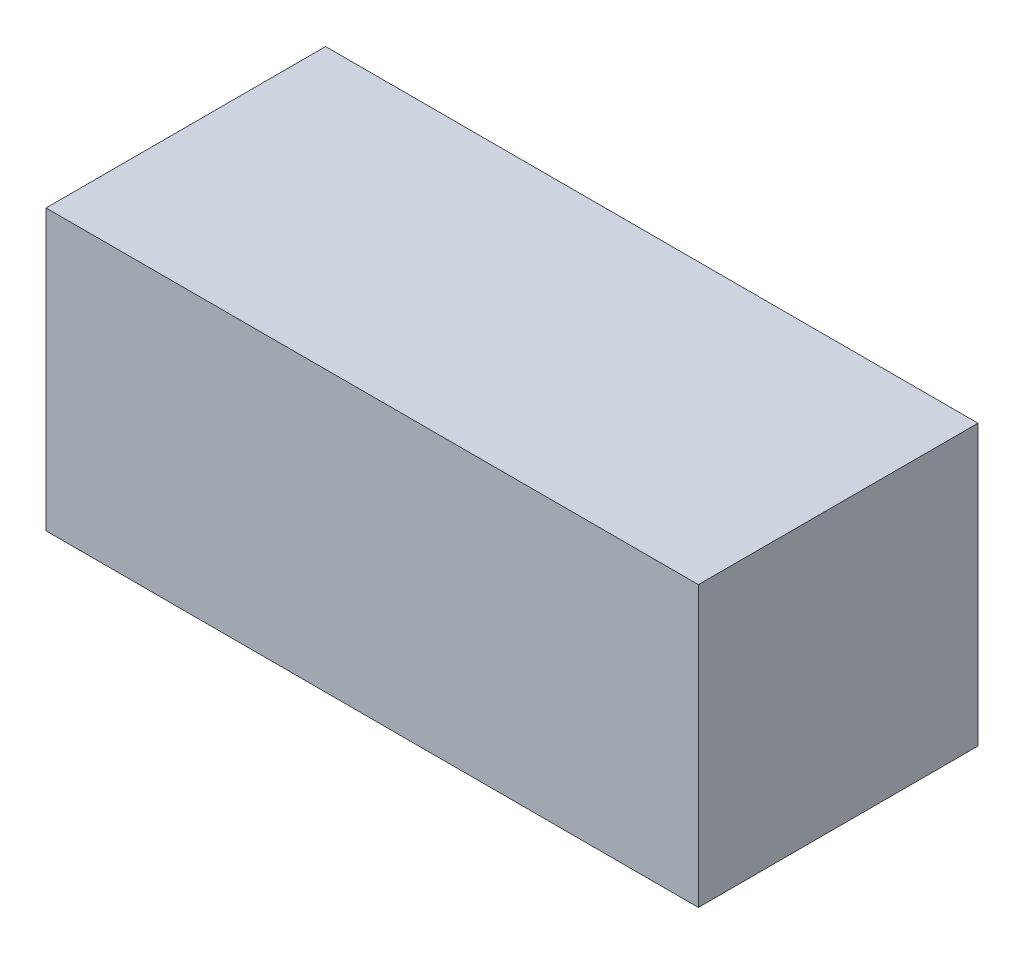
from build123d import *

# Parameters (mm, degrees)
SKETCH1_W           = 70
SKETCH1_H           = 30
BOSS_EXTRUDE1_DEPTH = 30


with BuildPart() as part:
    # Sketch1 → Boss-Extrude1 (new body)
    with BuildSketch(Plane(origin=(0, 0, 0), x_dir=(1, 0, 0), z_dir=(0, 1, 0))):
        Rectangle(SKETCH1_W, SKETCH1_H)
    extrude(amount=BOSS_EXTRUDE1_DEPTH)


solid = part.part
